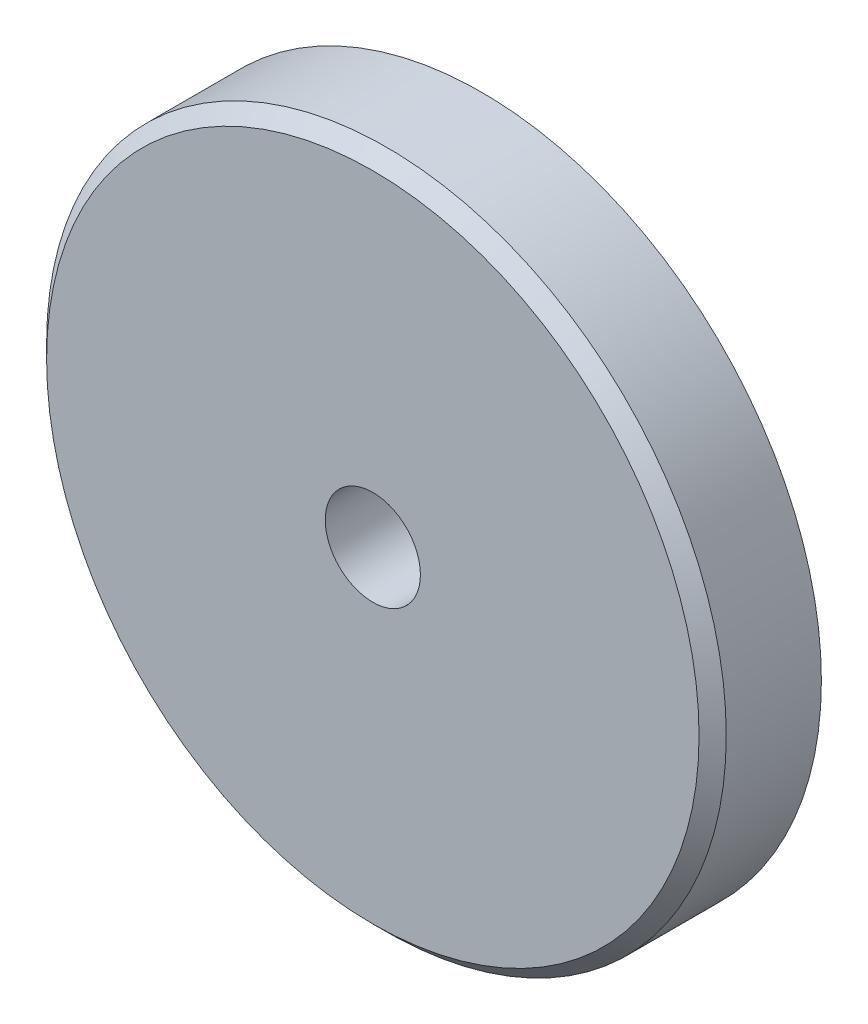
from build123d import *

# Parameters (mm, degrees)
SKETCH1_R           = 12.5
BOSS_EXTRUDE1_DEPTH = 4
CHAMFER1_SIZE       = 0.5
SKETCH7_R           = 1.25
CUT_EXTRUDE1_DEPTH  = 19.12456896
SKETCH10_R          = 1.75
CUT_EXTRUDE2_DEPTH  = 19.12456896


with BuildPart() as part:
    # Sketch1 → Boss-Extrude1 (new body)
    with BuildSketch(Plane.XY):
        Circle(SKETCH1_R)
    extrude(amount=BOSS_EXTRUDE1_DEPTH)

    # Chamfer1
    chamfer1_edges = [part.edges().sort_by_distance(p)[0] for p in [
        (-12.5, 0, 4),
    ]]
    chamfer(chamfer1_edges, length=CHAMFER1_SIZE)

    # Sketch7 → Cut-Extrude1 (cut, through all)
    with BuildSketch(Plane.XY.offset(4)):
        Circle(SKETCH7_R)
    extrude(amount=-CUT_EXTRUDE1_DEPTH, mode=Mode.SUBTRACT)

    # Sketch10 → Cut-Extrude2 (cut, through all)
    with BuildSketch(Plane.XY.offset(4)):
        Circle(SKETCH10_R)
    extrude(amount=-CUT_EXTRUDE2_DEPTH, mode=Mode.SUBTRACT)


solid = part.part
